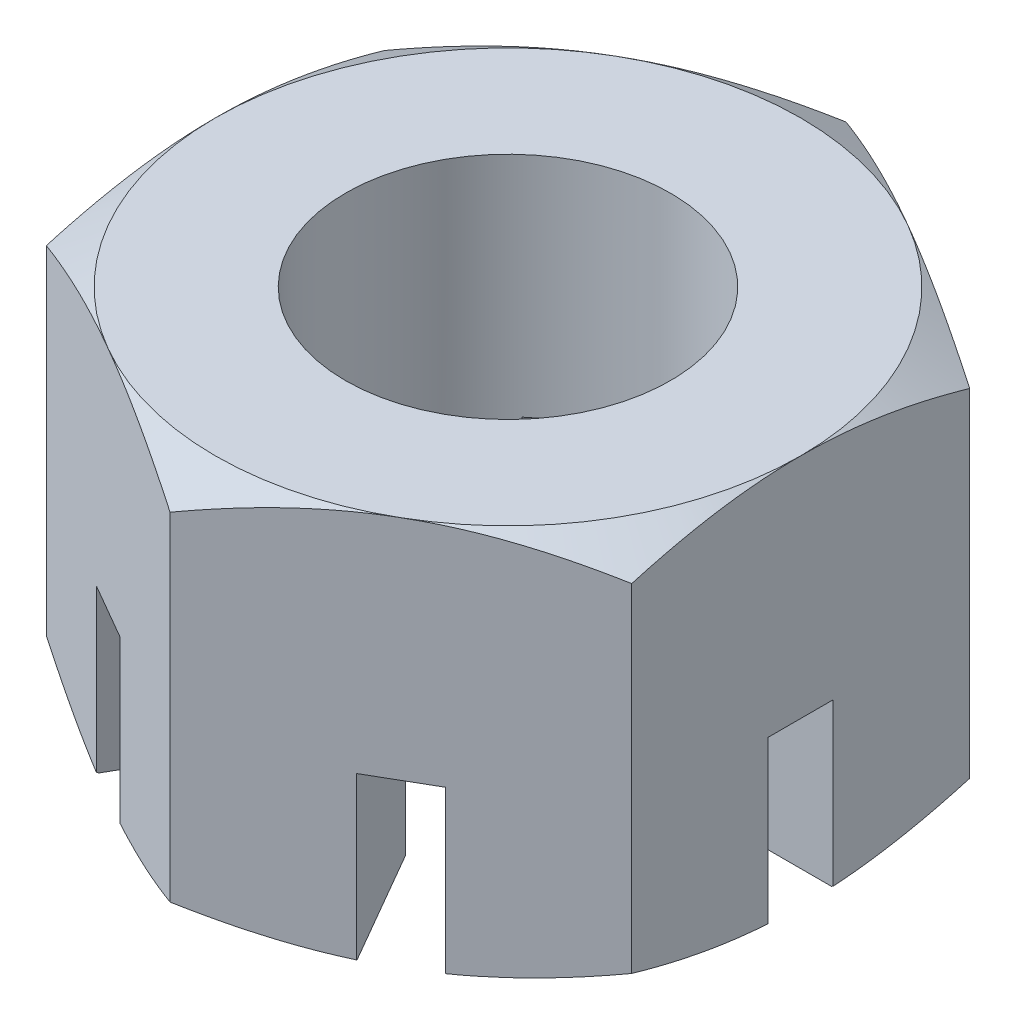
from build123d import *

# Parameters (mm, degrees)
SKETCH2_R           = 25
BOSS_EXTRUDE1_DEPTH = 30
SKETCH3_OUTSIDE_W   = 329.93
SKETCH3_OUTSIDE_H   = 343.864
SKETCH3_OUTSIDE_R   = 45.033320997
CUT_EXTRUDE1_DEPTH  = 60
CUT_EXTRUDE1_DRAFT  = -60
SKETCH4_OUTSIDE_W   = 329.93
SKETCH4_OUTSIDE_H   = 343.864
SKETCH4_OUTSIDE_R   = 45.033320997
CUT_EXTRUDE2_DEPTH  = 60
CUT_EXTRUDE2_DRAFT  = -60
SKETCH5_W           = 27.935883882
SKETCH5_H           = 10
CUT_EXTRUDE4_DEPTH  = 25


with BuildPart() as part:
    # Sketch2 → Boss-Extrude1 (new, symmetric)
    with BuildSketch(Plane(origin=(0, 0, 0), x_dir=(1, 0, 0), z_dir=(0, 1, 0))):
        Polygon((0, 52), (-45.033320997, 26), (-45.033320997, -26), (0, -52), (45.033320997, -26), (45.033320997, 26), align=None)
        with Locations(Location((0, 0, 0), (0, 0, 270))):
            Circle(SKETCH2_R, mode=Mode.SUBTRACT)
    extrude(amount=BOSS_EXTRUDE1_DEPTH, both=True)


with BuildPart() as cut_extrude1_tool:
    # Sketch3 outside → Cut-Extrude1 (with draft: the straight prism first)
    with BuildSketch(Plane(origin=(0, 30, 0), x_dir=(1, 0, 0), z_dir=(0, 1, 0))):
        Rectangle(SKETCH3_OUTSIDE_W, SKETCH3_OUTSIDE_H)
        Circle(SKETCH3_OUTSIDE_R, mode=Mode.SUBTRACT)
    extrude(amount=-CUT_EXTRUDE1_DEPTH)
    # Cut-Extrude1: the draft: its side faces are tilted about the plane it starts from
    cut_extrude1_sides = [cut_extrude1_tool.faces().sort_by_distance(p)[0] for p in [
        (0, 0, 171.932),
        (164.965, 0, 0),
        (0, 0, -171.932),
        (-164.965, 0, 0),
        (-45.033320997, 0, 0),
    ]]
    draft(cut_extrude1_sides, Plane(origin=(0, 30, 0), x_dir=(1, 0, 0), z_dir=(0, 1, 0)), CUT_EXTRUDE1_DRAFT)


with BuildPart() as part_1:
    add(part.part)

    # Cut-Extrude1: cut by cut_extrude1_tool
    add(cut_extrude1_tool.part, mode=Mode.SUBTRACT)


with BuildPart() as cut_extrude2_tool:
    # Sketch4 outside → Cut-Extrude2 (with draft: the straight prism first)
    with BuildSketch(Plane.XZ.offset(30)):
        Rectangle(SKETCH4_OUTSIDE_W, SKETCH4_OUTSIDE_H)
        Circle(SKETCH4_OUTSIDE_R, mode=Mode.SUBTRACT)
    extrude(amount=-CUT_EXTRUDE2_DEPTH)
    # Cut-Extrude2: the draft: its side faces are tilted about the plane it starts from
    cut_extrude2_sides = [cut_extrude2_tool.faces().sort_by_distance(p)[0] for p in [
        (0, 0, -171.932),
        (164.965, 0, 0),
        (0, 0, 171.932),
        (-164.965, 0, 0),
        (-45.033320997, 0, 0),
    ]]
    draft(cut_extrude2_sides, Plane.XZ.offset(30), CUT_EXTRUDE2_DRAFT)


with BuildPart() as part_2:
    add(part_1.part)

    # Cut-Extrude2: cut by cut_extrude2_tool
    add(cut_extrude2_tool.part, mode=Mode.SUBTRACT)

    # Sketch5 → Cut-Extrude4 (cut)
    with BuildSketch(Plane.XZ.offset(30)):
        with Locations((33.722829942, 0)):
            Rectangle(SKETCH5_W, SKETCH5_H)
        Polygon((19.515258923, -43.801419977), (5.547316982, -19.608234858), (14.20757102, -14.608234858), (28.175512961, -38.801419977), align=None)
        Polygon((-28.175512961, -38.801419977), (-14.20757102, -14.608234858), (-5.547316982, -19.608234858), (-19.515258923, -43.801419977), align=None)
        with Locations((-33.722829942, 0)):
            Rectangle(SKETCH5_W, SKETCH5_H)
        Polygon((-19.515258923, 43.801419977), (-5.547316982, 19.608234858), (-14.20757102, 14.608234858), (-28.175512961, 38.801419977), align=None)
        Polygon((28.175512961, 38.801419977), (14.20757102, 14.608234858), (5.547316982, 19.608234858), (19.515258923, 43.801419977), align=None)
    extrude(amount=-CUT_EXTRUDE4_DEPTH, mode=Mode.SUBTRACT)


solid = part_2.part
